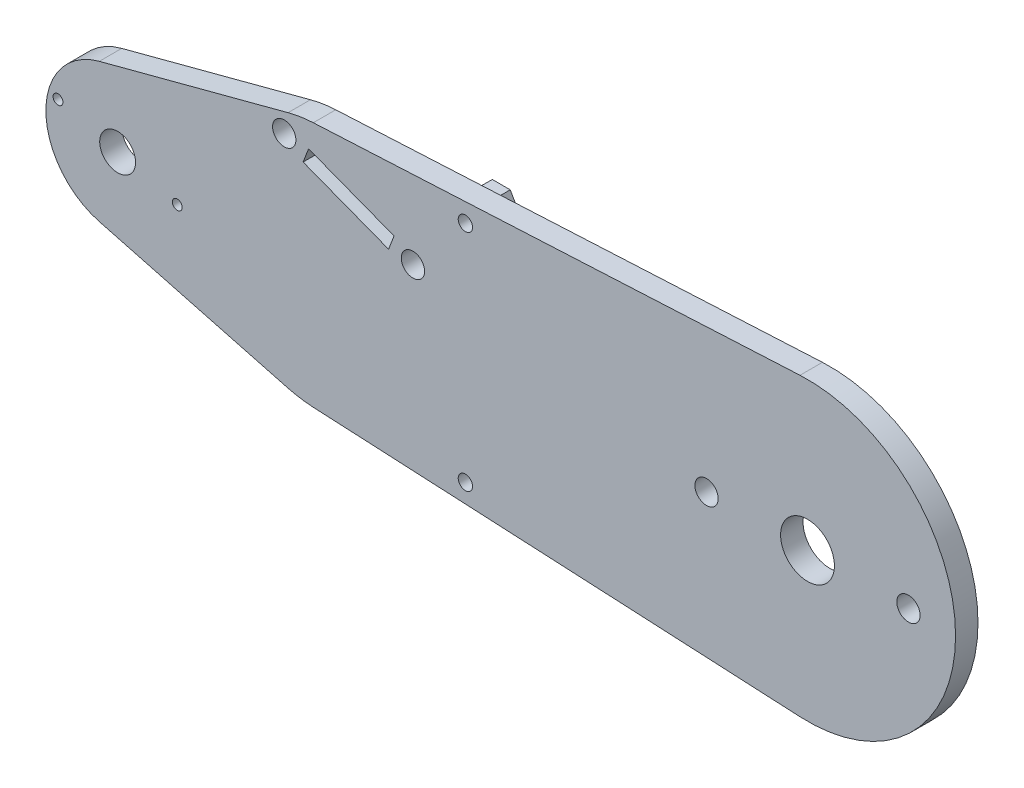
from build123d import *

# Parameters (mm, degrees)
SKETCH1_R           = 16
SKETCH1_R_2         = 4
SKETCH1_R_3         = 6
BOSS_EXTRUDE1_DEPTH = 5
SKETCH7_R           = 2.6
CUT_EXTRUDE1_DEPTH  = 7
BOSS_EXTRUDE6_DEPTH = 8
SKETCH9_R           = 1.6
CUT_EXTRUDE2_DEPTH  = 6
SKETCH10_R          = 2.6
BOSS_EXTRUDE7_DEPTH = 5
CUT_EXTRUDE4_START  = -10
SKETCH12_R          = 2.6
CUT_EXTRUDE4_DEPTH  = 10
SKETCH11_R          = 1.1
CUT_EXTRUDE3_DEPTH  = 6


with BuildPart() as part:
    # Sketch1 → Boss-Extrude1 (new body)
    # profile 1 of 3: a face of its own
    with BuildSketch(Plane.XY):
        with BuildLine():
            ThreePointArc((-63.902777778, -26.586845234), (-84.375, 0), (-63.902777778, 26.586845234))
            Line((-63.902777778, 26.586845234), (-105.963888889, 15.468709954))
            ThreePointArc((-105.963888889, 15.468709954), (-92.113397217, 12.677188612), (-85.875, 0))
            ThreePointArc((-85.875, 0), (-92.113397217, -12.677188612), (-105.963888889, -15.468709954))
            Line((-105.963888889, -15.468709954), (-63.902777778, -26.586845234))
        make_face()
    # profile 2 of 3: a face of its own
    with BuildSketch(Plane.XY):
        with Locations((-101.875, 0)):
            Circle(SKETCH1_R)
        with Locations((-101.875, 0)):
            Circle(SKETCH1_R_2, mode=Mode.SUBTRACT)
    # profile 3 of 3: a face of its own
    with BuildSketch(Plane.XY):
        with BuildLine():
            Line((-58.265804598, 27.46480771), (50.206034483, 32.957769253))
            ThreePointArc((50.206034483, 32.957769253), (84.875, 0), (50.206034483, -32.957769253))
            Line((50.206034483, -32.957769253), (-58.265804598, -27.46480771))
            ThreePointArc((-58.265804598, -27.46480771), (-84.375, 0), (-58.265804598, 27.46480771))
        make_face()
        with Locations((51.875, 0)):
            Circle(SKETCH1_R_3, mode=Mode.SUBTRACT)
    extrude(amount=BOSS_EXTRUDE1_DEPTH)

    # Sketch7 → Cut-Extrude1 (cut)
    with BuildSketch(Plane.XY.offset(5)):
        with Locations((29.375, 0)):
            Circle(SKETCH7_R)
        with Locations((74.375, 0)):
            Circle(SKETCH7_R)
    extrude(amount=-CUT_EXTRUDE1_DEPTH, mode=Mode.SUBTRACT)

    # Sketch8 → Boss-Extrude6 (add)
    with BuildSketch(Plane.XY.offset(5)):
        Polygon((-26.375, 28.464101615), (-28.375, 25), (-26.375, 21.535898385), (-22.375, 21.535898385), (-20.375, 25), (-22.375, 28.464101615), align=None)
        Polygon((-25.991580754, 27.8), (-27.608161507, 25), (-25.991580754, 22.2), (-22.758419246, 22.2), (-21.141838493, 25), (-22.758419246, 27.8), align=None, mode=Mode.SUBTRACT)
    boss_extrude6 = extrude(amount=-BOSS_EXTRUDE6_DEPTH)

    # Sketch9 → Cut-Extrude2 (cut)
    with BuildSketch(Plane.XY.offset(5)):
        with Locations((-24.375, 25)):
            Circle(SKETCH9_R)
    cut_extrude2 = extrude(amount=-CUT_EXTRUDE2_DEPTH, mode=Mode.SUBTRACT)

    # Mirror1: Boss-Extrude6 across plane
    add(boss_extrude6.mirror(Plane.ZX))

    # Mirror2: Cut-Extrude2 across plane
    add(cut_extrude2.mirror(Plane.ZX), mode=Mode.SUBTRACT)

    # Sketch10 → Boss-Extrude7 (add)
    with BuildSketch(Plane.XY.offset(5)):
        with Locations((-36.06831441, 11.178241177)):
            Circle(SKETCH10_R)
        with Locations(Location((-64.742423683, 22.173717984, 0), (0, 0, 180))):
            Circle(SKETCH10_R)
        Polygon((-41.60537748, 11.695000918), (-60.279486753, 18.855841852), (-59.205360613, 21.656958243), (-40.53125134, 14.496117309), align=None)
    extrude(amount=BOSS_EXTRUDE7_DEPTH)

    # Sketch12 → Cut-Extrude4 (cut)
    with BuildSketch(Plane.XY.offset(10).offset(CUT_EXTRUDE4_START)):
        with Locations((-36.06831441, 11.178241177)):
            Circle(SKETCH12_R)
        with Locations((-64.742423683, 22.173717984)):
            Circle(SKETCH12_R)
        Polygon((-59.320493296, 21.915307745), (-40.272901838, 14.611249993), (-41.490244797, 11.436651416), (-60.537836255, 18.740709168), align=None)
    extrude(amount=CUT_EXTRUDE4_DEPTH, mode=Mode.SUBTRACT)

    # Sketch11 → Cut-Extrude3 (cut)
    with BuildSketch(Plane.XY.offset(5)):
        with Locations((-88.581577383, -3.513888889)):
            Circle(SKETCH11_R)
        with Locations((-115.168422617, 3.513888889)):
            Circle(SKETCH11_R)
    extrude(amount=-CUT_EXTRUDE3_DEPTH, mode=Mode.SUBTRACT)


solid = part.part
